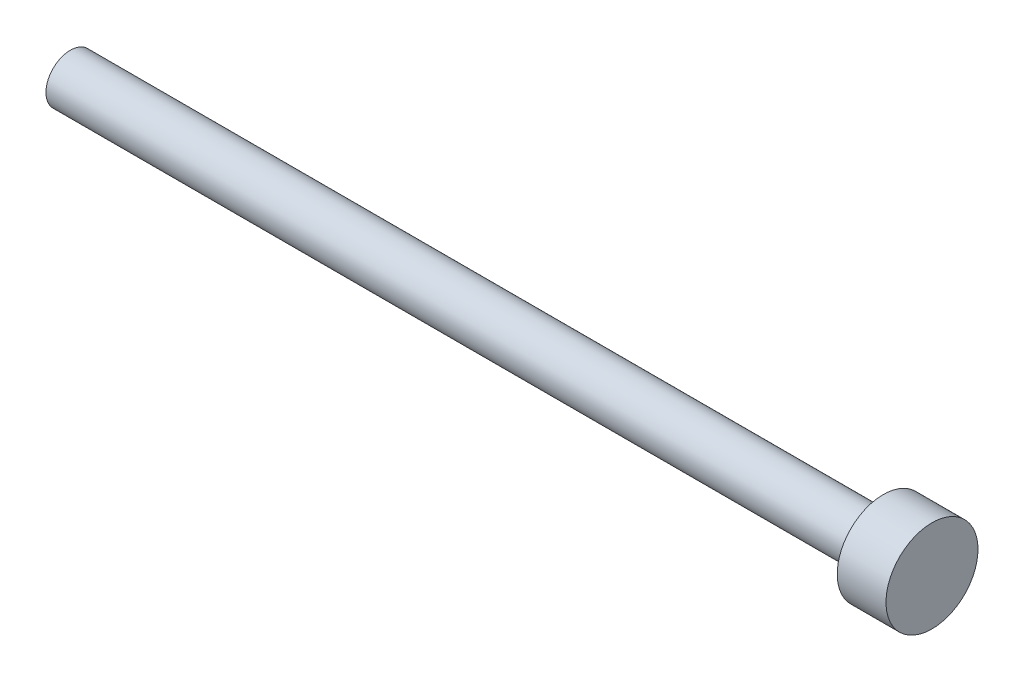
from build123d import *

# Parameters (mm, degrees)
SKETCH_1_R      = 1.5
EXTRUDE_2_DEPTH = 50
SKETCH_2_R      = 2.83
EXTRUDE_3_DEPTH = 3


with BuildPart() as part:
    # 草图1 → 凸台-拉伸2 (new body)
    with BuildSketch(Plane(origin=(0, 0, 0), x_dir=(0, 0, -1), z_dir=(1, 0, 0))):
        Circle(SKETCH_1_R)
    extrude(amount=EXTRUDE_2_DEPTH)

    # 草图2 → 凸台-拉伸3 (add)
    with BuildSketch(Plane(origin=(50, 0, 0), x_dir=(0, 0, -1), z_dir=(1, 0, 0))):
        Circle(SKETCH_2_R)
    extrude(amount=EXTRUDE_3_DEPTH)


solid = part.part
